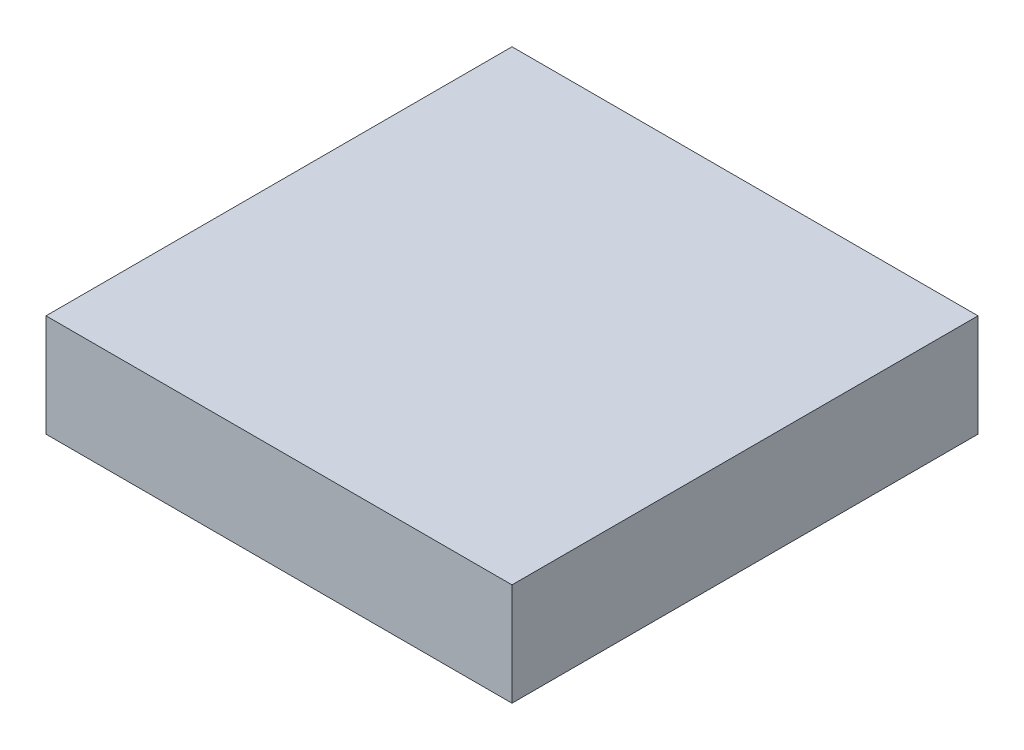
from build123d import *

# Parameters (mm, degrees)
SKETCH_1_W          = 150
SKETCH_1_H          = 150
EXTRUDE_1_DEPTH     = 33
SKETCH_2_W          = 138
SKETCH_2_H          = 138
CUT_EXTRUDE_1_DEPTH = 12


with BuildPart() as part:
    # Эскиз1 → Бобышка-Вытянуть1 (new body)
    with BuildSketch(Plane(origin=(0, 0, 0), x_dir=(1, 0, 0), z_dir=(0, 1, 0))):
        Rectangle(SKETCH_1_W, SKETCH_1_H)
    extrude(amount=EXTRUDE_1_DEPTH)

    # Эскиз2 → Вырез-Вытянуть1 (cut)
    with BuildSketch(Plane(origin=(0, 0, 0), x_dir=(-1, 0, 0), z_dir=(0, -1, 0))):
        Rectangle(SKETCH_2_W, SKETCH_2_H)
    extrude(amount=-CUT_EXTRUDE_1_DEPTH, mode=Mode.SUBTRACT)


solid = part.part
